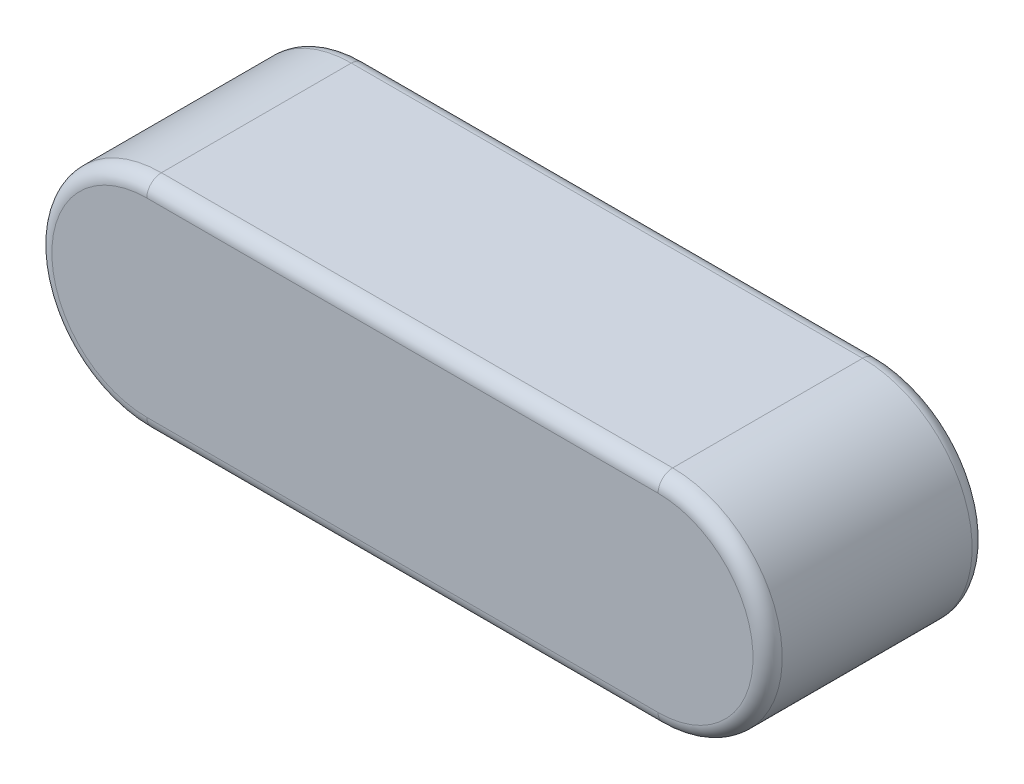
from build123d import *

# Parameters (mm, degrees)
EXTRUDE_527_DEPTH = 6
FILLET_1_R        = 0.4


with BuildPart() as part:
    # 草图1 → Extrude 527 (new body)
    with BuildSketch(Plane.XY):
        with BuildLine():
            Line((-7, 3), (7, 3))
            ThreePointArc((7, 3), (10, 0), (7, -3))
            Line((7, -3), (-7, -3))
            ThreePointArc((-7, -3), (-10, 0), (-7, 3))
        make_face()
    extrude(amount=EXTRUDE_527_DEPTH)

    # 圆角1
    fillet_1_edges = [part.edges().sort_by_distance(p)[0] for p in [
        (10, 0, 6),
        (0, 3, 6),
        (-10, 0, 6),
        (0, 3, 0),
        (10, 0, 0),
        (0, -3, 0),
        (-10, 0, 0),
        (0, -3, 6),
    ]]
    fillet(fillet_1_edges, radius=FILLET_1_R)


solid = part.part
